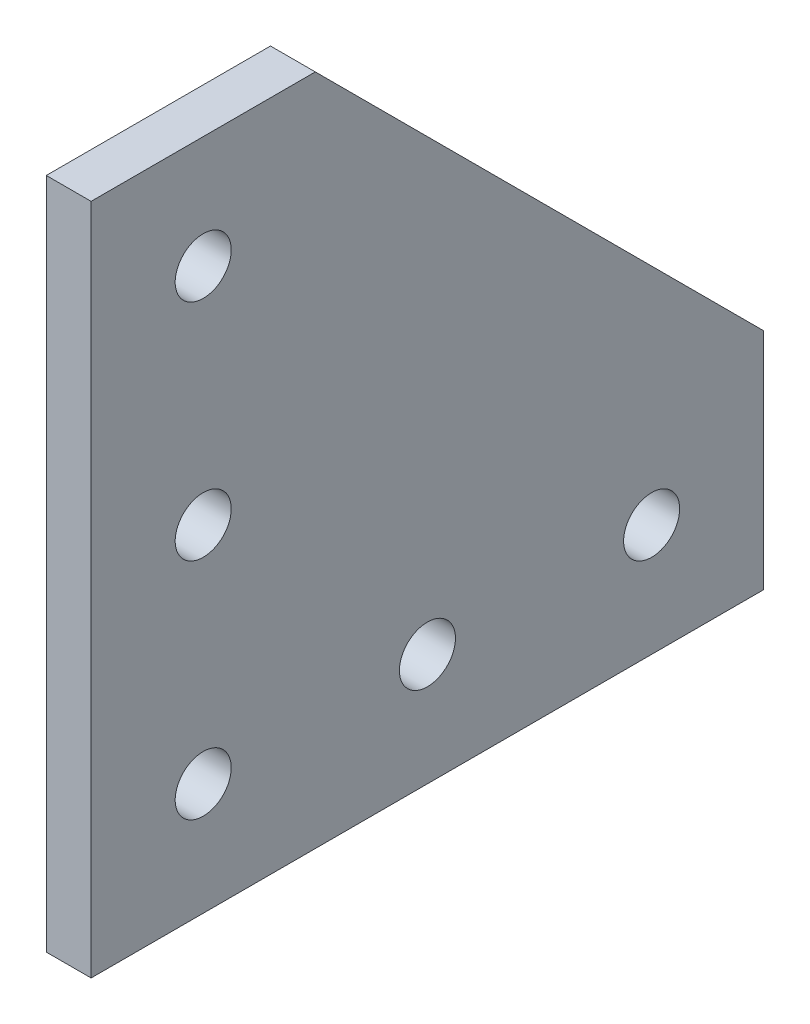
from build123d import *

# Parameters (mm, degrees)
SKETCH1_R           = 2.5
BOSS_EXTRUDE1_DEPTH = 4


with BuildPart() as part:
    # Sketch1 → Boss-Extrude1 (new body)
    with BuildSketch(Plane(origin=(0, 0, 0), x_dir=(0, 0, -1), z_dir=(1, 0, 0))):
        Polygon((0, 0), (0, 60), (20, 60), (60, 20), (60, 0), align=None)
        with Locations((10, 10)):
            Circle(SKETCH1_R, mode=Mode.SUBTRACT)
        with Locations((10, 30)):
            Circle(SKETCH1_R, mode=Mode.SUBTRACT)
        with Locations((10, 50)):
            Circle(SKETCH1_R, mode=Mode.SUBTRACT)
        with Locations((29.999999878, 10)):
            Circle(SKETCH1_R, mode=Mode.SUBTRACT)
        with Locations((49.999999756, 10)):
            Circle(SKETCH1_R, mode=Mode.SUBTRACT)
    extrude(amount=BOSS_EXTRUDE1_DEPTH)


solid = part.part
